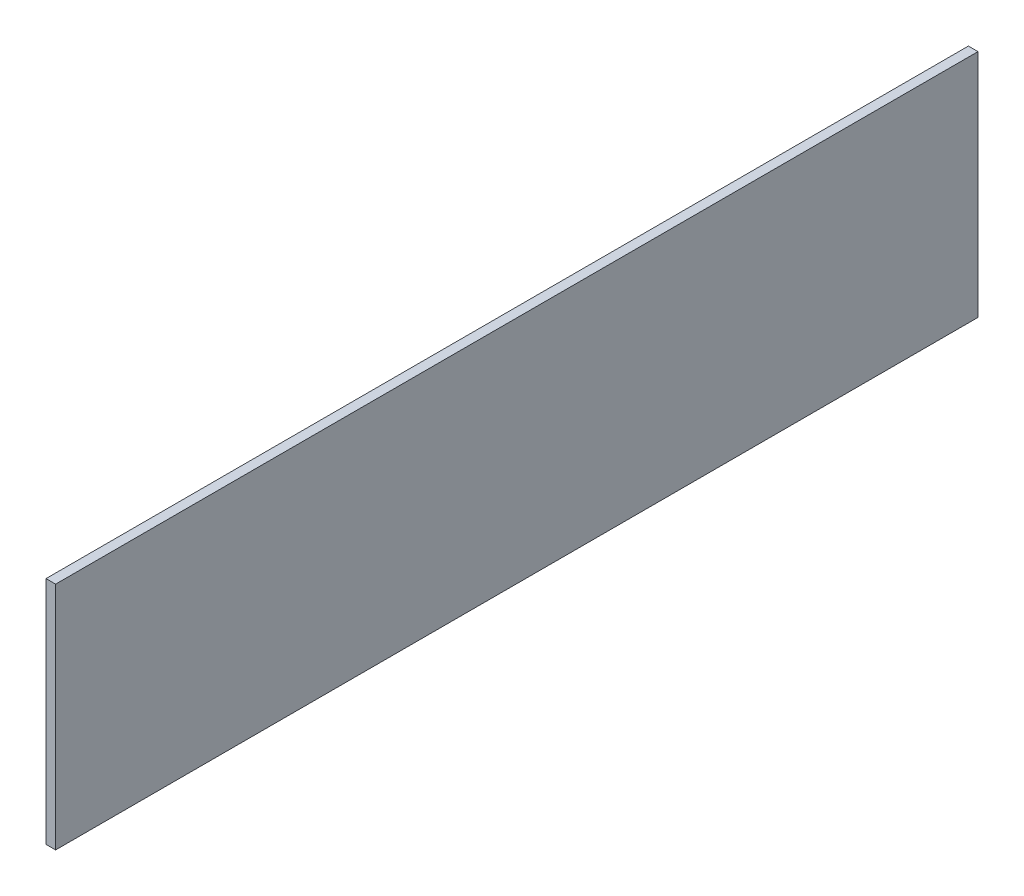
from build123d import *

# Parameters (mm, degrees)
SKETCH1_W           = 304.8
SKETCH1_H           = 76.073
BOSS_EXTRUDE1_DEPTH = 3.175


with BuildPart() as part:
    # Sketch1 → Boss-Extrude1 (new body)
    with BuildSketch(Plane(origin=(0, 0, 0), x_dir=(0, 0, -1), z_dir=(1, 0, 0))):
        with Locations((152.4, -38.0365)):
            Rectangle(SKETCH1_W, SKETCH1_H)
    extrude(amount=BOSS_EXTRUDE1_DEPTH)


solid = part.part
